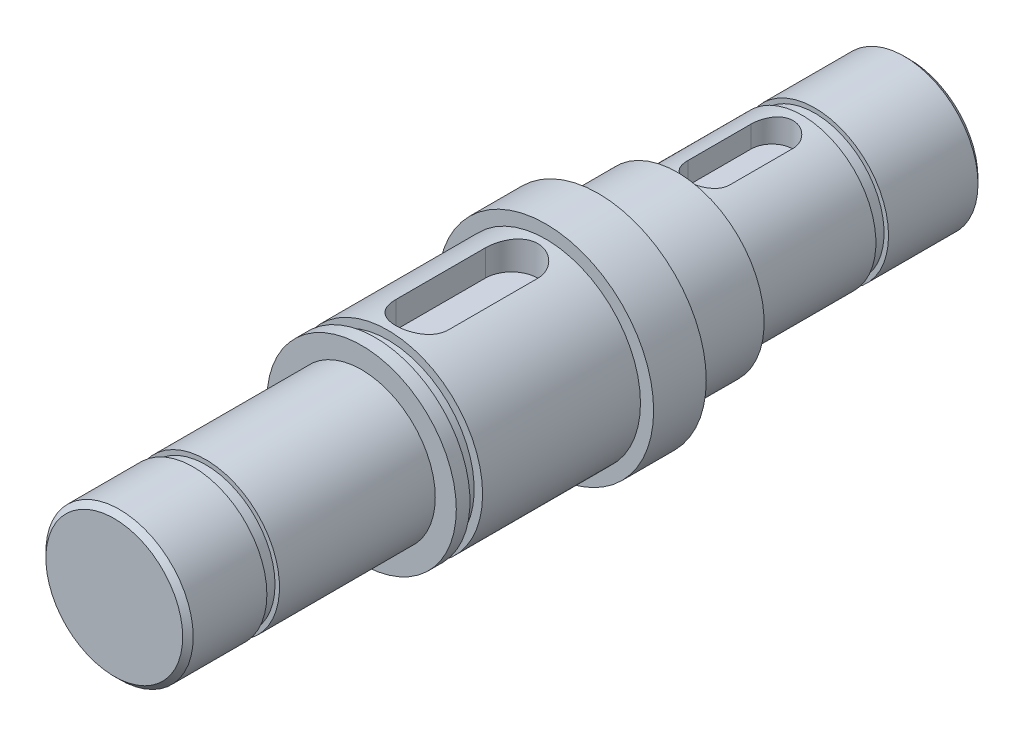
from build123d import *

# Parameters (mm, degrees)
BOSS_EXTRUDE1_DEPTH      = 5
BOSS_EXTRUDE1_DEPTH_BACK = 40
SKETCH1_R                = 18
SKETCH2_R                = 14
BOSS_EXTRUDE2_DEPTH      = 45
SKETCH3_R                = 14
BOSS_EXTRUDE3_DEPTH      = 15
BOSS_EXTRUDE4_START      = 47
SKETCH4_R                = 14
BOSS_EXTRUDE4_DEPTH      = 47
CUT_EXTRUDE1_START       = 1
CUT_EXTRUDE1_DEPTH       = 8
CUT_EXTRUDE2_DEPTH       = 8
SKETCH7_W                = 5.778552493
SKETCH7_H                = 10
SKETCH8_W                = 8.791380579
SKETCH8_H                = 2.4
CUT_EXTRUDE3_START       = -5
SKETCH12_R               = 15.75679301
SKETCH12_R_2             = 13.15
CUT_EXTRUDE3_DEPTH       = 2.4
BOSS_EXTRUDE5_START      = 25
SKETCH11_R               = 16.5
SKETCH11_R_2             = 14
BOSS_EXTRUDE5_DEPTH      = 10
SKETCH15_W               = 6.233882618
SKETCH15_H               = 2.4
CHAMFER1_SIZE            = 1
SKETCH16_R               = 16.5
BOSS_EXTRUDE6_DEPTH      = 10


with BuildPart() as part:
    # Sketch1 → Boss-Extrude1 (new, two sides: drawn at the far end of the back side and taken through both)
    with BuildSketch(Plane.XY.offset(-BOSS_EXTRUDE1_DEPTH_BACK)):
        Circle(SKETCH1_R)
    extrude(amount=BOSS_EXTRUDE1_DEPTH + BOSS_EXTRUDE1_DEPTH_BACK)

    # Sketch2 → Boss-Extrude2 (add)
    with BuildSketch(Plane(origin=(0, 0, -40), x_dir=(-1, 0, 0), z_dir=(0, 0, -1))):
        with Locations(Location((0, 0, 0), (0, 0, 180))):
            Circle(SKETCH2_R)
    extrude(amount=BOSS_EXTRUDE2_DEPTH)

    # Sketch3 → Boss-Extrude3 (add)
    with BuildSketch(Plane(origin=(0, 0, -85), x_dir=(-1, 0, 0), z_dir=(0, 0, -1))):
        with Locations(Location((0, 0, 0), (0, 0, 180))):
            Circle(SKETCH3_R)
    extrude(amount=BOSS_EXTRUDE3_DEPTH)

    # Sketch4 → Boss-Extrude4 (add)
    with BuildSketch(Plane.XY.offset(5).offset(BOSS_EXTRUDE4_START)):
        Circle(SKETCH4_R)
    extrude(amount=-BOSS_EXTRUDE4_DEPTH)

    # Sketch5 → Cut-Extrude1 (cut)
    with BuildSketch(Plane.XZ.offset(-21.3).offset(CUT_EXTRUDE1_START)):
        with BuildLine():
            Line((-5, -6.5), (-5, -23.5))
            ThreePointArc((-5, -23.5), (0, -28.5), (5, -23.5))
            Line((5, -23.5), (5, -6.5))
            ThreePointArc((5, -6.5), (0, -1.5), (-5, -6.5))
        make_face()
    extrude(amount=CUT_EXTRUDE1_DEPTH, mode=Mode.SUBTRACT)

    # Sketch6 → Cut-Extrude2 (cut)
    with BuildSketch(Plane.XZ.offset(-17.3)):
        with BuildLine():
            Line((-4, -61), (-4, -73))
            ThreePointArc((-4, -73), (0, -77), (4, -73))
            Line((4, -73), (4, -61))
            ThreePointArc((4, -61), (0, -57), (-4, -61))
        make_face()
    extrude(amount=CUT_EXTRUDE2_DEPTH, mode=Mode.SUBTRACT)

    # Sketch7 → Revolve1 (revolve)
    with BuildSketch(Plane(origin=(0, 0, 0), x_dir=(1, 0, 0), z_dir=(0, 1, 0))):
        with Locations((17.610723754, 35)):
            Rectangle(SKETCH7_W, SKETCH7_H)
    revolve(axis=Axis((0, 0, -30.114461013), (0, 0, -1)))

    # Sketch8 → Cut-Revolve1 (revolve, cut)
    with BuildSketch(Plane(origin=(0, 0, 0), x_dir=(1, 0, 0), z_dir=(0, 1, 0)), mode=Mode.PRIVATE) as cut_revolve1_sk:
        with Locations((20.79569029, -1.2)):
            Rectangle(SKETCH8_W, SKETCH8_H)
    revolve(cut_revolve1_sk.sketch.rotate(Axis((0, 0, 0), (0, 0, 1)), 180), axis=Axis((0, 0, 0), (0, 0, 1)), mode=Mode.SUBTRACT)

    # Sketch12 → Cut-Extrude3 (cut)
    with BuildSketch(Plane(origin=(0, 0, -83.741663421), x_dir=(-1, 0, 0), z_dir=(0, 0, -1)).offset(CUT_EXTRUDE3_START)):
        Circle(SKETCH12_R)
        Circle(SKETCH12_R_2, mode=Mode.SUBTRACT)
    extrude(amount=CUT_EXTRUDE3_DEPTH, mode=Mode.SUBTRACT)

    # Sketch11 → Boss-Extrude5 (add)
    with BuildSketch(Plane.XY.offset(-60).offset(BOSS_EXTRUDE5_START)):
        Circle(SKETCH11_R)
        Circle(SKETCH11_R_2, mode=Mode.SUBTRACT)
    extrude(amount=-BOSS_EXTRUDE5_DEPTH)

    # Sketch15 → Cut-Revolve2 (revolve, cut)
    with BuildSketch(Plane(origin=(0, 0, 0), x_dir=(1, 0, 0), z_dir=(0, 1, 0)), mode=Mode.PRIVATE) as cut_revolve2_sk:
        with Locations((16.266941309, -35.8)):
            Rectangle(SKETCH15_W, SKETCH15_H)
    revolve(cut_revolve2_sk.sketch.rotate(Axis((0, 0, 52), (0, 0, -1)), 180), axis=Axis((0, 0, 52), (0, 0, -1)), mode=Mode.SUBTRACT)

    # SurfaceCut1
    split(bisect_by=Plane.XY.offset(-99.141663421), keep=Keep.TOP)

    # Chamfer1
    chamfer1_edges = [part.edges().sort_by_distance(p)[0] for p in [
        (-14, 0, 52),
        (-14, 0, -99.141663421),
    ]]
    chamfer(chamfer1_edges, length=CHAMFER1_SIZE)

    # Sketch16 → Boss-Extrude6 (add)
    with BuildSketch(Plane(origin=(0, 0, -45), x_dir=(-1, 0, 0), z_dir=(0, 0, -1))):
        Circle(SKETCH16_R)
    extrude(amount=BOSS_EXTRUDE6_DEPTH)


solid = part.part
